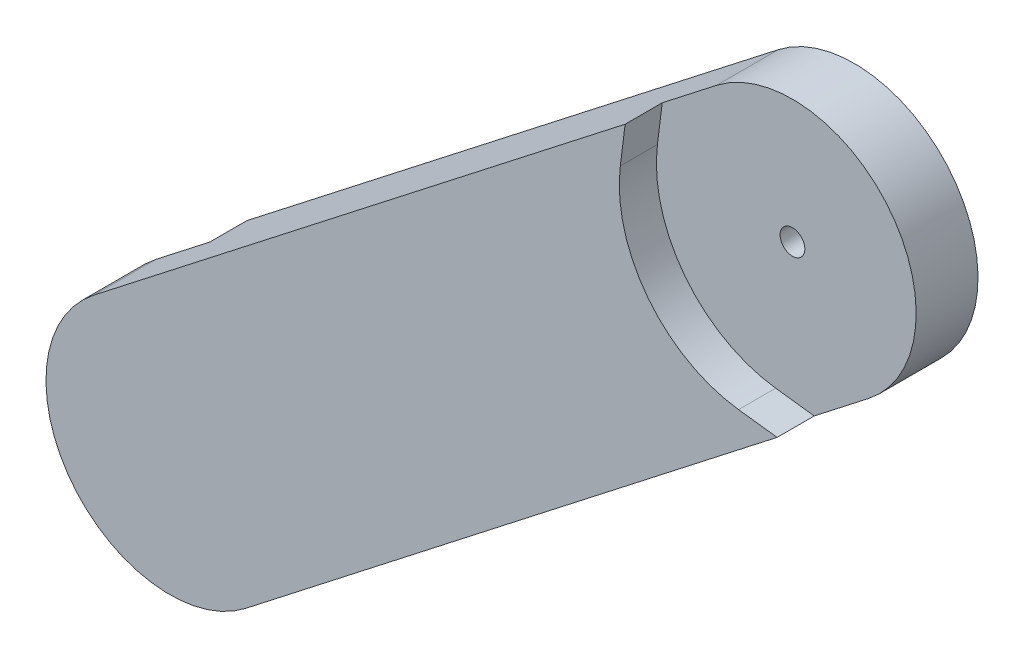
from build123d import *

# Parameters (mm, degrees)
BOSS_EXTRUDE1_DEPTH     = 20
CUT_EXTRUDE1_DEPTH      = 7.5
SKETCH3_R               = 2.5
CUT_EXTRUDE2_DEPTH      = 5
CUT_EXTRUDE3_START      = -7.5
SKETCH4_R               = 25
CUT_EXTRUDE3_DEPTH      = 7.5
CUT_EXTRUDE4_DEPTH      = 7.5
CUT_EXTRUDE5_DEPTH      = 187.21329098
CUT_EXTRUDE5_DEPTH_BACK = 7.5
SKETCH7_R               = 2.5
CUT_EXTRUDE6_DEPTH      = 186.557645323


with BuildPart() as part:
    # Sketch1 → Boss-Extrude1 (new body)
    with BuildSketch(Plane.XY):
        with BuildLine():
            Line((-15.358937815, 19.725694644), (102.995230052, 111.879321533))
            ThreePointArc((102.995230052, 111.879321533), (138.079862511, 107.512564703), (133.713105681, 72.427932244))
            Line((133.713105681, 72.427932244), (15.358937815, -19.725694644))
            ThreePointArc((15.358937815, -19.725694644), (-19.725694644, -15.358937815), (-15.358937815, 19.725694644))
        make_face()
    extrude(amount=BOSS_EXTRUDE1_DEPTH)

    # Sketch2 → Cut-Extrude1 (cut)
    with BuildSketch(Plane(origin=(0, 0, 0), x_dir=(-1, 0, 0), z_dir=(0, 0, -1))):
        with BuildLine():
            ThreePointArc((15.358937815, 19.725694644), (-19.725694644, 15.358937815), (-15.358937815, -19.725694644))
            ThreePointArc((-15.358937815, -19.725694644), (10.977853949, -22.460781881), (25, 0))
            ThreePointArc((25, 0), (22.460781881, 10.977853949), (15.358937815, 19.725694644))
        make_face()
    extrude(amount=-CUT_EXTRUDE1_DEPTH, mode=Mode.SUBTRACT)

    # Sketch3 → Cut-Extrude2 (cut)
    with BuildSketch(Plane(origin=(0, 0, 7.5), x_dir=(-1, 0, 0), z_dir=(0, 0, -1))):
        Circle(SKETCH3_R)
    extrude(amount=-CUT_EXTRUDE2_DEPTH, mode=Mode.SUBTRACT)

    # Sketch4 → Cut-Extrude3 (cut)
    with BuildSketch(Plane.XY.offset(20).offset(CUT_EXTRUDE3_START)):
        with Locations((118.354167866, 92.153626888)):
            Circle(SKETCH4_R)
    extrude(amount=CUT_EXTRUDE3_DEPTH, mode=Mode.SUBTRACT)

    # Sketch5 → Cut-Extrude4 (cut)
    with BuildSketch(Plane(origin=(0, 0, 0), x_dir=(-1, 0, 0), z_dir=(0, 0, -1))):
        with BuildLine():
            ThreePointArc((-3.396539703, 27.28943968), (-13.581209957, 23.912355302), (-21.698264109, 16.894831596))
            Line((-21.698264109, 16.894831596), (-19.725694644, 15.358937815))
            ThreePointArc((-19.725694644, 15.358937815), (-3.087763366, 24.808581527), (15.358937815, 19.725694644))
            Line((15.358937815, 19.725694644), (4.398653076, 28.259656807))
            Line((4.398653076, 28.259656807), (-3.396539703, 27.28943968))
        make_face()
        with BuildLine():
            Line((-27.28943968, -3.396539703), (-26.319222553, -11.191732482))
            Line((-26.319222553, -11.191732482), (-15.358937815, -19.725694644))
            ThreePointArc((-15.358937815, -19.725694644), (-24.808581527, -3.087763366), (-19.725694644, 15.358937815))
            Line((-19.725694644, 15.358937815), (-21.698264109, 16.894831596))
            ThreePointArc((-21.698264109, 16.894831596), (-26.511954246, 7.305222931), (-27.28943968, -3.396539703))
        make_face()
    extrude(amount=-CUT_EXTRUDE4_DEPTH, mode=Mode.SUBTRACT)

    # Sketch6 → Cut-Extrude5 (cut, two sides: drawn at the far end of the back side and taken through both)
    with BuildSketch(Plane.XY.offset(20).offset(-CUT_EXTRUDE5_DEPTH_BACK)):
        with BuildLine():
            Line((98.628473222, 76.794689074), (96.655903758, 75.258795292))
            ThreePointArc((96.655903758, 75.258795292), (104.77295791, 68.241271586), (114.957628164, 64.864187208))
            Line((114.957628164, 64.864187208), (122.752820943, 63.893970081))
            Line((122.752820943, 63.893970081), (133.713105681, 72.427932244))
            ThreePointArc((133.713105681, 72.427932244), (115.2664045, 67.345045361), (98.628473222, 76.794689074))
        make_face()
        with BuildLine():
            ThreePointArc((91.064728186, 95.550166591), (91.842213621, 84.848403957), (96.655903758, 75.258795292))
            Line((96.655903758, 75.258795292), (98.628473222, 76.794689074))
            ThreePointArc((98.628473222, 76.794689074), (93.545586339, 95.241390254), (102.995230052, 111.879321533))
            Line((102.995230052, 111.879321533), (92.034945313, 103.34535937))
            Line((92.034945313, 103.34535937), (91.064728186, 95.550166591))
        make_face()
    extrude(amount=CUT_EXTRUDE5_DEPTH + CUT_EXTRUDE5_DEPTH_BACK, mode=Mode.SUBTRACT)

    # Sketch7 → Cut-Extrude6 (cut, through all)
    with BuildSketch(Plane.XY.offset(12.5)):
        with Locations((118.354167866, 92.153626888)):
            Circle(SKETCH7_R)
    extrude(amount=-CUT_EXTRUDE6_DEPTH, mode=Mode.SUBTRACT)


solid = part.part
